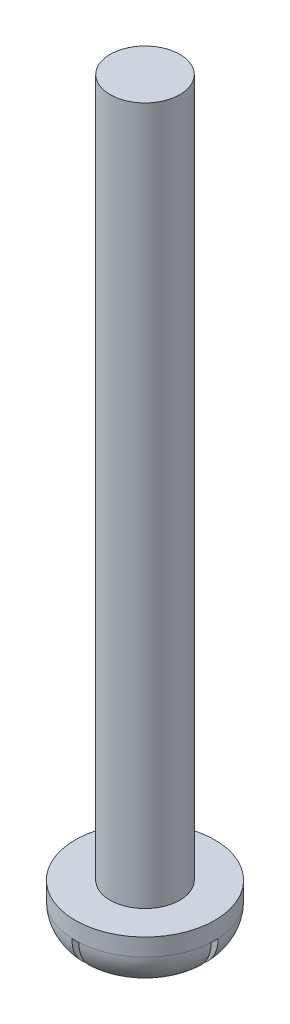
from build123d import *

# Parameters (mm, degrees)
SKETCH_1_R               = 2
EXTRUDE_1_DEPTH          = 1.5
SKETCH_2_R               = 1
EXTRUDE_2_DEPTH          = 20
CUT_EXTRUDE_1_DEPTH      = 22.685248442
CUT_EXTRUDE_1_DEPTH_BACK = 1
SKETCH_4_W               = 4
SKETCH_4_H               = 0.2
SKETCH_4_W_2             = 0.2
SKETCH_4_H_2             = 4
FILLET_1_R               = 1


with BuildPart() as part:
    # 草图1 → 凸台-拉伸1 (new body)
    with BuildSketch(Plane(origin=(0, 0, 0), x_dir=(1, 0, 0), z_dir=(0, 1, 0))):
        Circle(SKETCH_1_R)
    extrude(amount=-EXTRUDE_1_DEPTH)

    # 草图2 → 凸台-拉伸2 (add)
    with BuildSketch(Plane(origin=(0, 0, 0), x_dir=(1, 0, 0), z_dir=(0, 1, 0))):
        Circle(SKETCH_2_R)
    extrude(amount=EXTRUDE_2_DEPTH)

    # 草图4 → 切除-拉伸-薄壁1 (cut, two sides: drawn at the far end of the back side and taken through both)
    with BuildSketch(Plane.XZ.offset(1.5).offset(-CUT_EXTRUDE_1_DEPTH_BACK)):
        Rectangle(SKETCH_4_W, SKETCH_4_H)
        Rectangle(SKETCH_4_W_2, SKETCH_4_H_2)
    extrude(amount=CUT_EXTRUDE_1_DEPTH + CUT_EXTRUDE_1_DEPTH_BACK, mode=Mode.SUBTRACT)

    # 圆角1
    fillet_1_edges = [part.edges().sort_by_distance(p)[0] for p in [
        (1.414213562, -1.5, 1.414213562),
        (-1.414213562, -1.5, 1.414213562),
        (-1.414213562, -1.5, -1.414213562),
        (1.414213562, -1.5, -1.414213562),
    ]]
    fillet(fillet_1_edges, radius=FILLET_1_R)


solid = part.part
